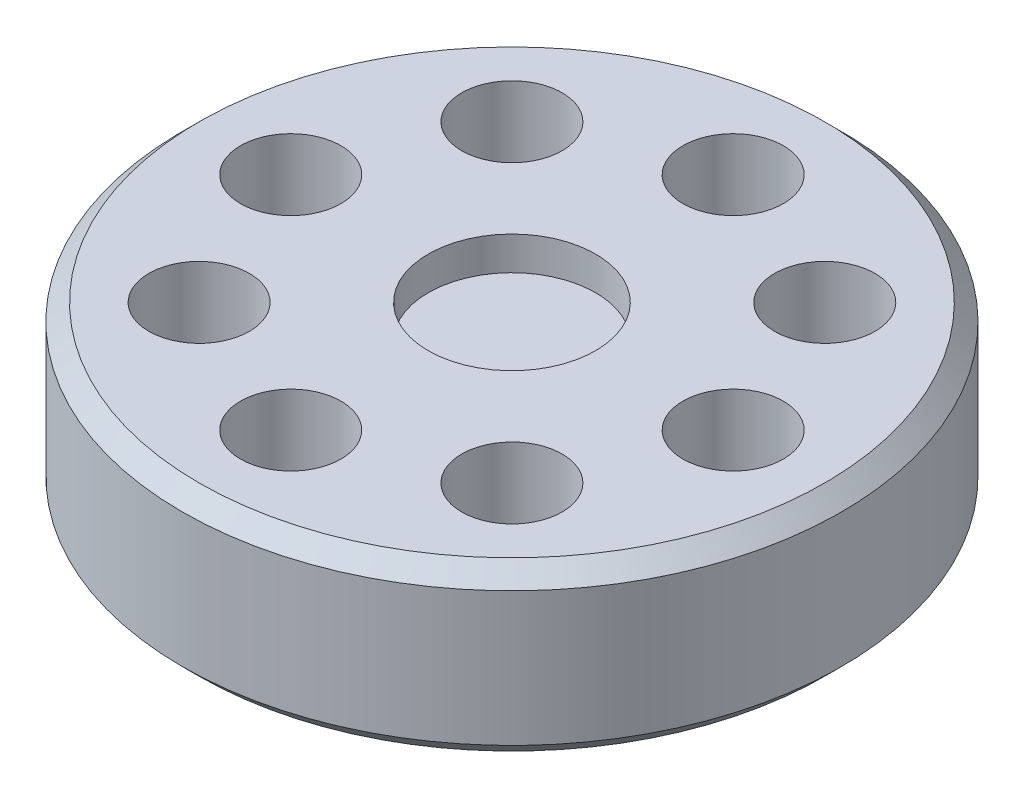
from build123d import *

# Parameters (mm, degrees)
WHEEL_CIRCLE_R     = 50
WHEEL_THICK_DEPTH  = 25.4
SKETCH2_R          = 12.7
CUT_EXTRUDE1_DEPTH = 5.08
CHAMFER3_SIZE      = 2.54
SKETCH4_R          = 7.62
CUT_EXTRUDE2_DEPTH = 76.134279793


with BuildPart() as part:
    # Wheel_Circle → Wheel_thick (new body)
    with BuildSketch(Plane(origin=(0, 0, 0), x_dir=(1, 0, 0), z_dir=(0, 1, 0))):
        with Locations(Location((0, 0, 0), (0, 0, 270))):
            Circle(WHEEL_CIRCLE_R)
    extrude(amount=WHEEL_THICK_DEPTH)

    # Sketch2 → Cut-Extrude1 (cut)
    with BuildSketch(Plane(origin=(0, 25.4, 0), x_dir=(1, 0, 0), z_dir=(0, 1, 0))):
        with Locations(Location((0, 0, 0), (0, 0, 270))):
            Circle(SKETCH2_R)
    extrude(amount=-CUT_EXTRUDE1_DEPTH, mode=Mode.SUBTRACT)

    # Chamfer3
    chamfer3_edges = [part.edges().sort_by_distance(p)[0] for p in [
        (0, 0, -50),
        (0, 25.4, -50),
    ]]
    chamfer(chamfer3_edges, length=CHAMFER3_SIZE)

    # Sketch4 → Cut-Extrude2 (cut, through all)
    with BuildSketch(Plane(origin=(0, 25.4, 0), x_dir=(1, 0, 0), z_dir=(0, 1, 0))):
        with BuildLine():
            ThreePointArc((33.559287835, 7.62), (28.171134162, 5.388153673), (25.939287835, 0))
            Line((25.939287835, 0), (33.559287835, 0))
            Line((33.559287835, 0), (33.559287835, 7.62))
        make_face()
        with BuildLine():
            Line((33.559287835, 0), (25.939287835, 0))
            ThreePointArc((25.939287835, 0), (28.171134162, -5.388153673), (33.559287835, -7.62))
            Line((33.559287835, -7.62), (33.559287835, 0))
        make_face()
        with BuildLine():
            Line((33.559287835, 7.62), (33.559287835, 0))
            Line((33.559287835, 0), (41.179287835, 0))
            ThreePointArc((41.179287835, 0), (38.947441508, 5.388153673), (33.559287835, 7.62))
        make_face()
        with BuildLine():
            Line((41.179287835, 0), (33.559287835, 0))
            Line((33.559287835, 0), (33.559287835, -7.62))
            ThreePointArc((33.559287835, -7.62), (38.947441508, -5.388153673), (41.179287835, 0))
        make_face()
        with BuildLine():
            ThreePointArc((29.118153673, -18.341846327), (23.73, -16.11), (18.341846327, -18.341846327))
            Line((18.341846327, -18.341846327), (23.73, -23.73))
            Line((23.73, -23.73), (29.118153673, -18.341846327))
        make_face()
        with BuildLine():
            Line((23.73, -23.73), (18.341846327, -18.341846327))
            ThreePointArc((18.341846327, -18.341846327), (16.11, -23.73), (18.341846327, -29.118153673))
            Line((18.341846327, -29.118153673), (23.73, -23.73))
        make_face()
        with BuildLine():
            Line((29.118153673, -18.341846327), (23.73, -23.73))
            Line((23.73, -23.73), (29.118153673, -29.118153673))
            ThreePointArc((29.118153673, -29.118153673), (30.769962038, -26.646047755), (31.35, -23.73))
            ThreePointArc((31.35, -23.73), (30.769962038, -20.813952245), (29.118153673, -18.341846327))
        make_face()
        with BuildLine():
            Line((29.118153673, -29.118153673), (23.73, -23.73))
            Line((23.73, -23.73), (18.341846327, -29.118153673))
            ThreePointArc((18.341846327, -29.118153673), (23.73, -31.35), (29.118153673, -29.118153673))
        make_face()
        with BuildLine():
            ThreePointArc((7.62, -33.559287835), (5.388153673, -28.171134162), (0, -25.939287835))
            Line((0, -25.939287835), (0, -33.559287835))
            Line((0, -33.559287835), (7.62, -33.559287835))
        make_face()
        with BuildLine():
            Line((0, -33.559287835), (0, -25.939287835))
            ThreePointArc((0, -25.939287835), (-5.388153673, -28.171134162), (-7.62, -33.559287835))
            Line((-7.62, -33.559287835), (0, -33.559287835))
        make_face()
        with BuildLine():
            Line((7.62, -33.559287835), (0, -33.559287835))
            Line((0, -33.559287835), (0, -41.179287835))
            ThreePointArc((0, -41.179287835), (5.388153673, -38.947441508), (7.62, -33.559287835))
        make_face()
        with BuildLine():
            Line((0, -41.179287835), (0, -33.559287835))
            Line((0, -33.559287835), (-7.62, -33.559287835))
            ThreePointArc((-7.62, -33.559287835), (-5.388153673, -38.947441508), (0, -41.179287835))
        make_face()
        with BuildLine():
            ThreePointArc((-16.11, -23.73), (-16.690037962, -20.813952245), (-18.341846327, -18.341846327))
            Line((-18.341846327, -18.341846327), (-23.73, -23.73))
            Line((-23.73, -23.73), (-18.341846327, -29.118153673))
            ThreePointArc((-18.341846327, -29.118153673), (-16.690037962, -26.646047755), (-16.11, -23.73))
        make_face()
        with BuildLine():
            Line((-23.73, -23.73), (-18.341846327, -18.341846327))
            ThreePointArc((-18.341846327, -18.341846327), (-23.73, -16.11), (-29.118153673, -18.341846327))
            Line((-29.118153673, -18.341846327), (-23.73, -23.73))
        make_face()
        with BuildLine():
            Line((-18.341846327, -29.118153673), (-23.73, -23.73))
            Line((-23.73, -23.73), (-29.118153673, -29.118153673))
            ThreePointArc((-29.118153673, -29.118153673), (-23.73, -31.35), (-18.341846327, -29.118153673))
        make_face()
        with BuildLine():
            Line((-29.118153673, -29.118153673), (-23.73, -23.73))
            Line((-23.73, -23.73), (-29.118153673, -18.341846327))
            ThreePointArc((-29.118153673, -18.341846327), (-31.35, -23.73), (-29.118153673, -29.118153673))
        make_face()
        with BuildLine():
            ThreePointArc((-33.559287835, -7.62), (-28.171134162, -5.388153673), (-25.939287835, 0))
            Line((-25.939287835, 0), (-33.559287835, 0))
            Line((-33.559287835, 0), (-33.559287835, -7.62))
        make_face()
        with BuildLine():
            Line((-33.559287835, 0), (-25.939287835, 0))
            ThreePointArc((-25.939287835, 0), (-28.171134162, 5.388153673), (-33.559287835, 7.62))
            Line((-33.559287835, 7.62), (-33.559287835, 0))
        make_face()
        with BuildLine():
            Line((-33.559287835, -7.62), (-33.559287835, 0))
            Line((-33.559287835, 0), (-41.179287835, 0))
            ThreePointArc((-41.179287835, 0), (-38.947441508, -5.388153673), (-33.559287835, -7.62))
        make_face()
        with BuildLine():
            Line((-41.179287835, 0), (-33.559287835, 0))
            Line((-33.559287835, 0), (-33.559287835, 7.62))
            ThreePointArc((-33.559287835, 7.62), (-38.947441508, 5.388153673), (-41.179287835, 0))
        make_face()
        with BuildLine():
            ThreePointArc((-29.118153673, 18.341846327), (-23.73, 16.11), (-18.341846327, 18.341846327))
            Line((-18.341846327, 18.341846327), (-23.73, 23.73))
            Line((-23.73, 23.73), (-29.118153673, 18.341846327))
        make_face()
        with BuildLine():
            Line((-23.73, 23.73), (-18.341846327, 18.341846327))
            ThreePointArc((-18.341846327, 18.341846327), (-16.690037962, 20.813952245), (-16.11, 23.73))
            ThreePointArc((-16.11, 23.73), (-16.690037962, 26.646047755), (-18.341846327, 29.118153673))
            Line((-18.341846327, 29.118153673), (-23.73, 23.73))
        make_face()
        with BuildLine():
            Line((-29.118153673, 18.341846327), (-23.73, 23.73))
            Line((-23.73, 23.73), (-29.118153673, 29.118153673))
            ThreePointArc((-29.118153673, 29.118153673), (-31.35, 23.73), (-29.118153673, 18.341846327))
        make_face()
        with BuildLine():
            Line((-29.118153673, 29.118153673), (-23.73, 23.73))
            Line((-23.73, 23.73), (-18.341846327, 29.118153673))
            ThreePointArc((-18.341846327, 29.118153673), (-23.73, 31.35), (-29.118153673, 29.118153673))
        make_face()
        with Locations(Location((23.73, 23.73, 0), (0, 0, 270))):
            Circle(SKETCH4_R)
        with Locations(Location((0, 33.559287835, 0), (0, 0, 270))):
            Circle(SKETCH4_R)
    extrude(amount=-CUT_EXTRUDE2_DEPTH, mode=Mode.SUBTRACT)


solid = part.part
